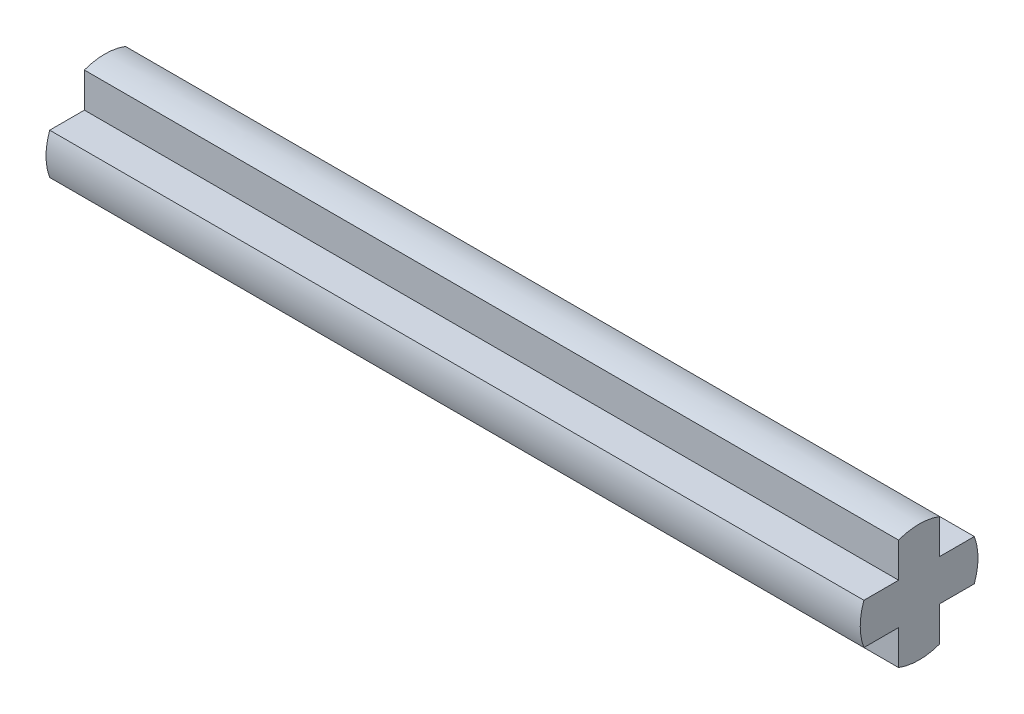
from build123d import *

# Parameters (mm, degrees)
BOSS_EXTRUDE1_DEPTH = 31.8


with BuildPart() as part:
    # Sketch1 → Boss-Extrude1 (new body)
    with BuildSketch(Plane(origin=(0, 0, 0), x_dir=(0, 0, -1), z_dir=(1, 0, 0))):
        with BuildLine():
            Line((-2.156385865, 0.8), (-0.8, 0.8))
            Line((-0.8, 0.8), (-0.8, 2.156385865))
            add(Edge.make_bspline(
                [(-0.8, 2.156385865), (0, 2.443614135), (0.8, 2.156385865)],
                knots=[0, 0, 0, 1, 1, 1], degree=2))
            Line((0.8, 2.156385865), (0.8, 0.8))
            Line((0.8, 0.8), (2.156385865, 0.8))
            add(Edge.make_bspline(
                [(2.156385865, 0.8), (2.443614135, 0), (2.156385865, -0.8)],
                knots=[0, 0, 0, 1, 1, 1], degree=2))
            Line((2.156385865, -0.8), (0.8, -0.8))
            Line((0.8, -0.8), (0.8, -2.156385865))
            add(Edge.make_bspline(
                [(0.8, -2.156385865), (0, -2.443614135), (-0.8, -2.156385865)],
                knots=[0, 0, 0, 1, 1, 1], degree=2))
            Line((-0.8, -2.156385865), (-0.8, -0.8))
            Line((-0.8, -0.8), (-2.156385865, -0.8))
            add(Edge.make_bspline(
                [(-2.156385865, -0.8), (-2.443614135, 0), (-2.156385865, 0.8)],
                knots=[0, 0, 0, 1, 1, 1], degree=2))
        make_face()
    extrude(amount=BOSS_EXTRUDE1_DEPTH)


solid = part.part
